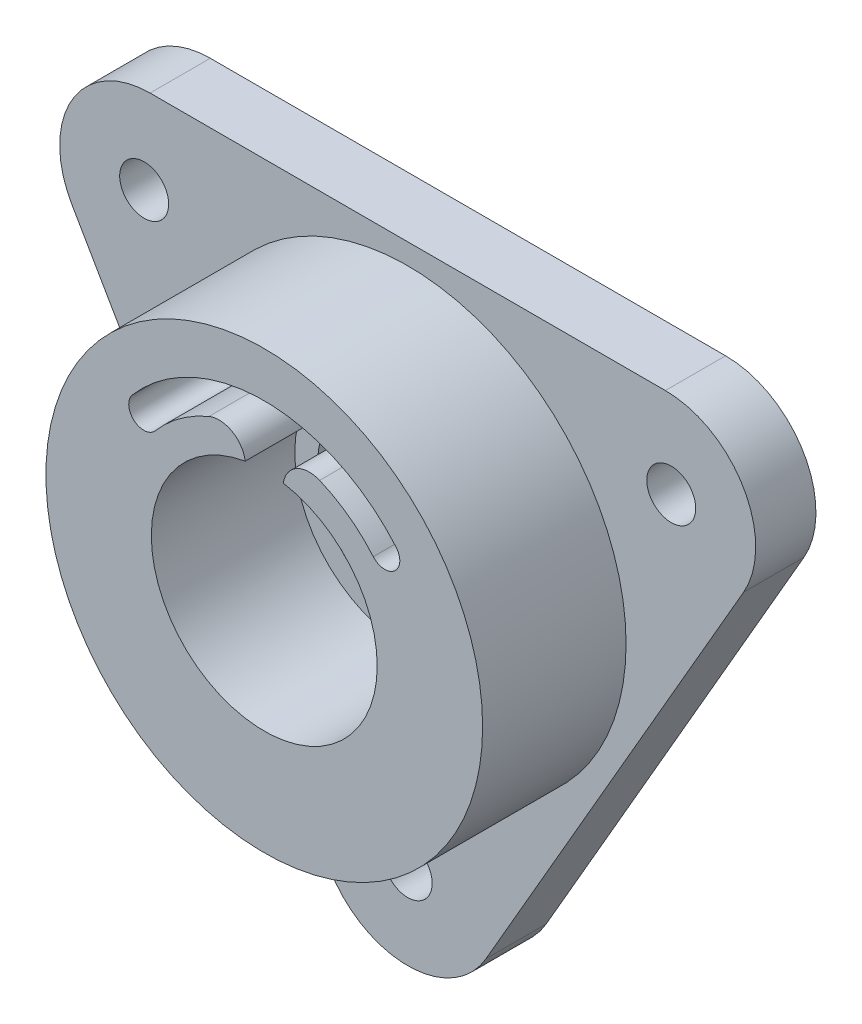
from build123d import *

# Parameters (mm, degrees)
ESQUISSE3_R             = 1.625
ESQUISSE3_R_2           = 6
BOSS_EXTRU_1_DEPTH      = 4
ESQUISSE4_R             = 14.5
ESQUISSE4_R_2           = 7.5
BOSS_EXTRU_2_DEPTH      = 9.525
CONG_3_R                = 6
ENL_V_MAT_EXTRU_1_DEPTH = 38.150684462
ENL_V_MAT_EXTRU_2_DEPTH = 38.150684462


with BuildPart() as part:
    # Esquisse3 → Boss.-Extru.1 (new body)
    with BuildSketch(Plane.XY):
        Polygon((0, -31.754264805), (-27.5, 15.877132403), (27.5, 15.877132403), align=None)
        with Locations((-17.5, 10.103629711)):
            Circle(ESQUISSE3_R, mode=Mode.SUBTRACT)
        with Locations((17.5, 10.103629711)):
            Circle(ESQUISSE3_R, mode=Mode.SUBTRACT)
        with Locations((0, -20.207259422)):
            Circle(ESQUISSE3_R, mode=Mode.SUBTRACT)
        Circle(ESQUISSE3_R_2, mode=Mode.SUBTRACT)
    extrude(amount=BOSS_EXTRU_1_DEPTH)

    # Esquisse4 → Boss.-Extru.2 (add)
    with BuildSketch(Plane.XY.offset(4)):
        Circle(ESQUISSE4_R)
        Circle(ESQUISSE4_R_2, mode=Mode.SUBTRACT)
    extrude(amount=BOSS_EXTRU_2_DEPTH)

    # Congé3
    cong_3_edges = [part.edges().sort_by_distance(p)[0] for p in [
        (0, -31.754264805, 2),
        (-27.5, 15.877132403, 2),
        (27.5, 15.877132403, 2),
    ]]
    fillet(cong_3_edges, radius=CONG_3_R)

    # Esquisse5 → Enlèv. mat.-Extru.1 (cut, through all)
    with BuildSketch(Plane.XY.offset(13.525)):
        with BuildLine():
            ThreePointArc((-7.238095238, 6.153046183), (0, 9.5), (7.238095238, 6.153046183))
            ThreePointArc((7.238095238, 6.153046183), (8.647689072, 6.038830492), (8.761904762, 7.448424326))
            ThreePointArc((8.761904762, 7.448424326), (0, 11.5), (-8.761904762, 7.448424326))
            ThreePointArc((-8.761904762, 7.448424326), (-8.647689072, 6.038830492), (-7.238095238, 6.153046183))
        make_face()
    extrude(amount=-ENL_V_MAT_EXTRU_1_DEPTH, mode=Mode.SUBTRACT)

    # Esquisse6 → Enlèv. mat.-Extru.2 (cut, through all)
    with BuildSketch(Plane.XY.offset(13.525)):
        with BuildLine():
            ThreePointArc((-2.322580645, 5.532234553), (-1.386431589, 7.823222319), (-3.677419355, 8.759371375))
            ThreePointArc((-3.677419355, 8.759371375), (0, 9.5), (3.677419355, 8.759371375))
            ThreePointArc((3.677419355, 8.759371375), (1.386431589, 7.823222319), (2.322580645, 5.532234553))
            ThreePointArc((2.322580645, 5.532234553), (0, 6), (-2.322580645, 5.532234553))
        make_face()
    extrude(amount=-ENL_V_MAT_EXTRU_2_DEPTH, mode=Mode.SUBTRACT)


solid = part.part
